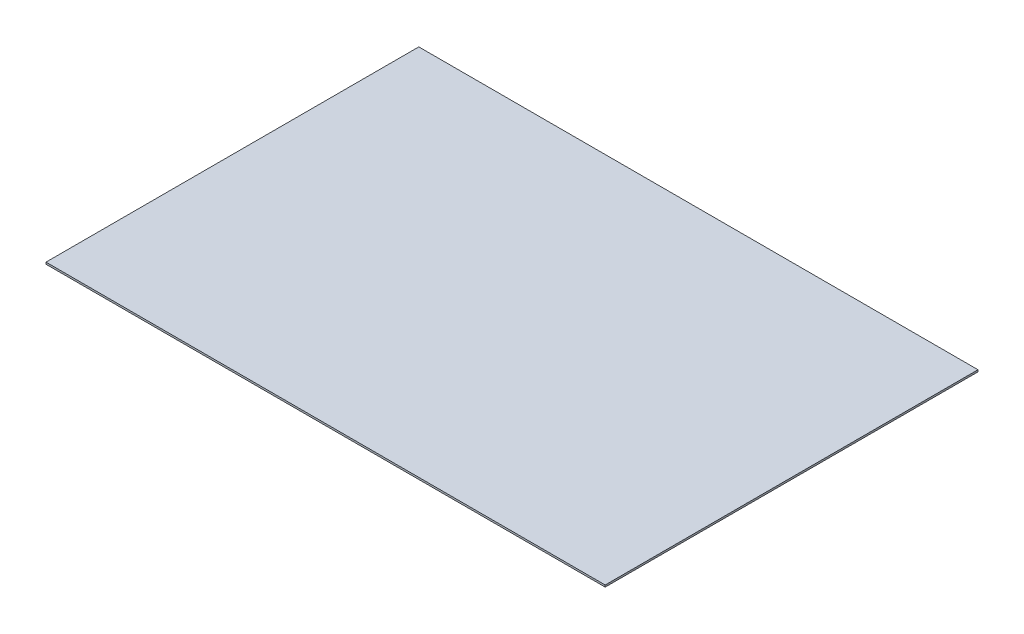
from build123d import *

# Parameters (mm, degrees)
SKETCH_1_W      = 1500
SKETCH_1_H      = 1000
EXTRUDE_1_DEPTH = 5


with BuildPart() as part:
    # Эскиз1 → Бобышка-Вытянуть1 (new body)
    with BuildSketch(Plane(origin=(0, 0, 0), x_dir=(1, 0, 0), z_dir=(0, 1, 0))):
        Rectangle(SKETCH_1_W, SKETCH_1_H)
    extrude(amount=EXTRUDE_1_DEPTH)


solid = part.part
